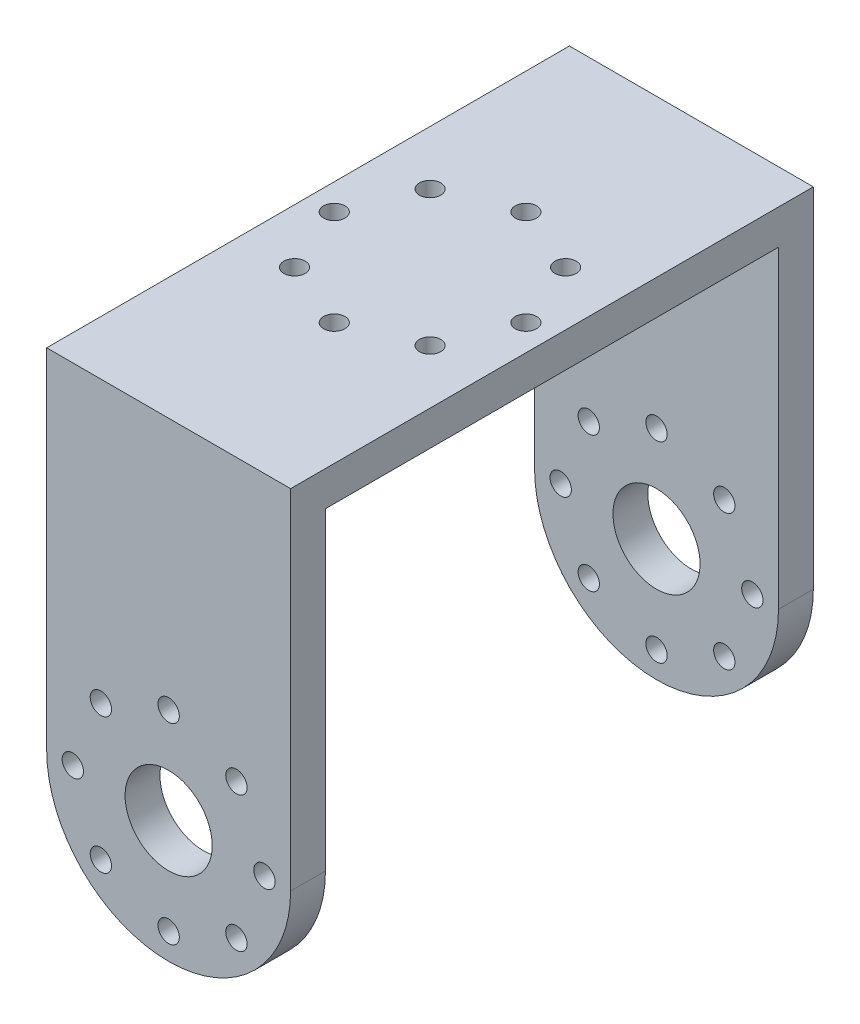
from build123d import *

# Parameters (mm, degrees)
SKETCH_2_R          = 5
SKETCH_2_R_2        = 1.225
EXTRUDE_1_DEPTH     = 60
SKETCH_9_W          = 52
SKETCH_9_H          = 50
CUT_EXTRUDE_1_DEPTH = 60
SKETCH_10_R         = 1.225
CUT_EXTRUDE_2_DEPTH = 60


with BuildPart() as part:
    # 스케치2 → 보스-돌출1 (new body)
    with BuildSketch(Plane.XY):
        with BuildLine():
            Line((-14, 0), (-14, 40))
            Line((-14, 40), (14, 40))
            Line((14, 40), (14, 0))
            ThreePointArc((14, 0), (0, -14), (-14, 0))
        make_face()
        Circle(SKETCH_2_R, mode=Mode.SUBTRACT)
        with Locations((0, 11)):
            Circle(SKETCH_2_R_2, mode=Mode.SUBTRACT)
        with Locations((7.778174593, 7.778174593)):
            Circle(SKETCH_2_R_2, mode=Mode.SUBTRACT)
        with Locations((11, 0)):
            Circle(SKETCH_2_R_2, mode=Mode.SUBTRACT)
        with Locations((7.778174593, -7.778174593)):
            Circle(SKETCH_2_R_2, mode=Mode.SUBTRACT)
        with Locations((0, -11)):
            Circle(SKETCH_2_R_2, mode=Mode.SUBTRACT)
        with Locations((-7.778174593, -7.778174593)):
            Circle(SKETCH_2_R_2, mode=Mode.SUBTRACT)
        with Locations((-11, 0)):
            Circle(SKETCH_2_R_2, mode=Mode.SUBTRACT)
        with Locations((-7.778174593, 7.778174593)):
            Circle(SKETCH_2_R_2, mode=Mode.SUBTRACT)
    extrude(amount=EXTRUDE_1_DEPTH)

    # 스케치9 → 컷-돌출1 (cut)
    with BuildSketch(Plane(origin=(14, 0, 0), x_dir=(0, 0, -1), z_dir=(1, 0, 0))):
        with Locations((-30, 11)):
            Rectangle(SKETCH_9_W, SKETCH_9_H)
    extrude(amount=-CUT_EXTRUDE_1_DEPTH, mode=Mode.SUBTRACT)

    # 스케치10 → 컷-돌출2 (cut)
    with BuildSketch(Plane(origin=(0, 40, 0), x_dir=(1, 0, 0), z_dir=(0, 1, 0))):
        with Locations(Location((-7.774774878, -22.215482705, 0), (0, 0, 270))):
            Circle(SKETCH_10_R)
        with Locations(Location((0.003399715, -18.993657298, 0), (0, 0, 270))):
            Circle(SKETCH_10_R)
        with Locations(Location((7.781574308, -22.215482705, 0), (0, 0, 270))):
            Circle(SKETCH_10_R)
        with Locations(Location((11.003399715, -29.993657298, 0), (0, 0, 270))):
            Circle(SKETCH_10_R)
        with Locations(Location((7.781574308, -37.771831891, 0), (0, 0, 270))):
            Circle(SKETCH_10_R)
        with Locations(Location((0.003399715, -40.993657298, 0), (0, 0, 270))):
            Circle(SKETCH_10_R)
        with Locations(Location((-7.774774878, -37.771831891, 0), (0, 0, 270))):
            Circle(SKETCH_10_R)
        with Locations(Location((-10.996600285, -29.993657298, 0), (0, 0, 270))):
            Circle(SKETCH_10_R)
    extrude(amount=-CUT_EXTRUDE_2_DEPTH, mode=Mode.SUBTRACT)


solid = part.part
